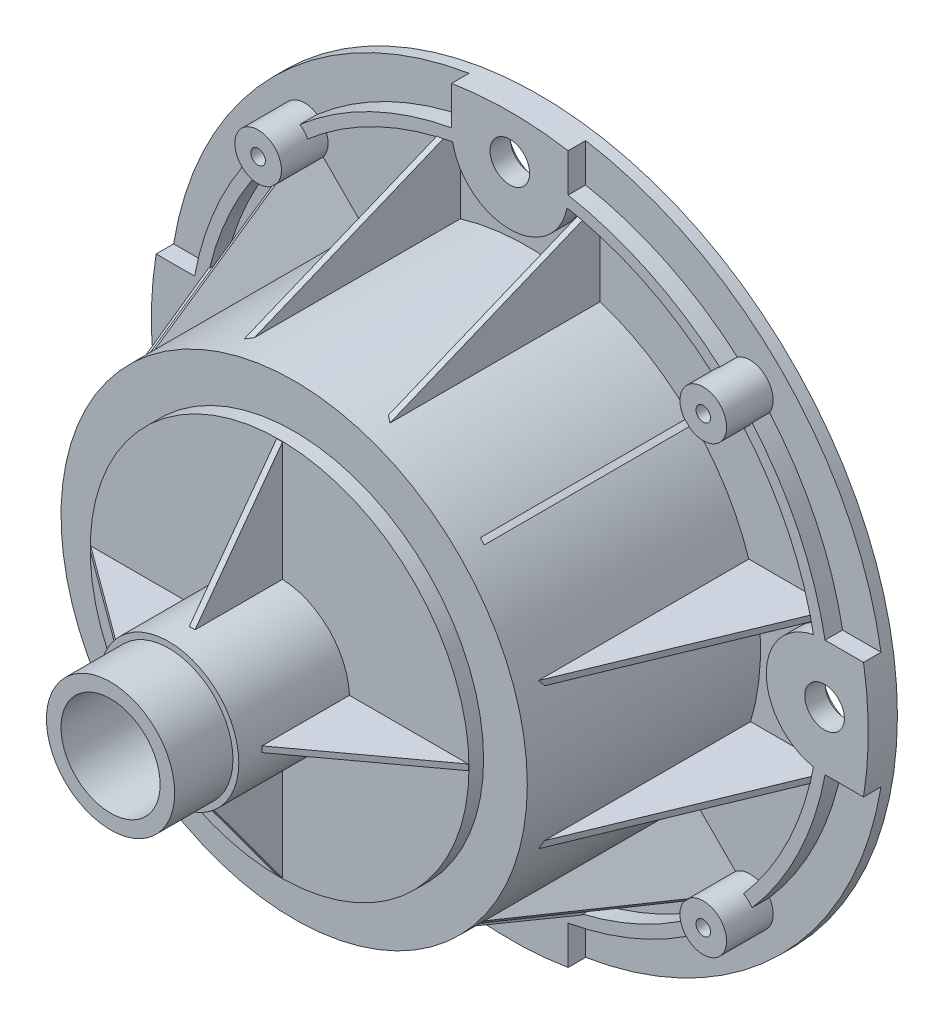
from build123d import *

# Parameters (mm, degrees)
SKETCH_2_R                         = 40
EXTRUDE_1_DEPTH                    = 46
EXTRUDE_START                      = 4
SKETCH_3_R                         = 61.5
EXTRUDE_2_DEPTH                    = 2
EXTRUDE_START_2                    = -2
EXTRUDE_3_DEPTH                    = 5
PATTERN_CIRCULAR_1_COUNT           = 4
SKETCH_5_R                         = 55
SKETCH_5_R_2                       = 53
EXTRUDE_1_2_DEPTH                  = 3
SKETCH_6_R                         = 4
EXTRUDE_4_DEPTH                    = 8
PATTERN_CIRCULAR_2_COUNT           = 4
SKETCH_7_R                         = 32.5
EXTRUDE_5_DEPTH                    = 2.5
SKETCH_8_R                         = 38
CUT_EXTRUDE_1_DEPTH                = 44
SKETCH_10_R                        = 30.5
CUT_EXTRUDE_2_DEPTH                = 2.5
EXTRUDE_7_DEPTH                    = 29
EXTRUDE_7_DEPTH_BACK               = 5
SKETCH_13_R                        = 12
SKETCH_14_OUTSIDE_W                = 163.086
SKETCH_14_OUTSIDE_H                = 163.086
SKETCH_14_OUTSIDE_R                = 11
CUT_EXTRUDE_3_DEPTH                = 10
SKETCH_15_R                        = 8.5
CUT_EXTRUDE_4_DEPTH                = 117.493562054
EXTRUDE_START_3                    = 3
EXTRUDE_8_DEPTH                    = 3
PATTERN_CIRCULAR_3_COUNT           = 8
RIB_1_REACH                        = 118.494
SKETCH_17_WALL_W                   = 260.308261522
SKETCH_17_WALL_H                   = 1
PATTERN_CIRCULAR_4_COUNT           = 4
RIB_2_REACH                        = 125.251
SKETCH_18_WALL_W                   = 284.190764808
SKETCH_18_WALL_H                   = 1
PATTERN_CIRCULAR_5_COPY_1_REACH    = 125.251
PATTERN_CIRCULAR_5_COPY_1_SKETCH_W = 284.190764808
PATTERN_CIRCULAR_5_COPY_1_SKETCH_H = 1
PATTERN_CIRCULAR_5_COPY_2_REACH    = 125.251
PATTERN_CIRCULAR_5_COPY_2_SKETCH_W = 284.190764808
PATTERN_CIRCULAR_5_COPY_2_SKETCH_H = 1
PATTERN_CIRCULAR_5_COPY_3_REACH    = 125.251
PATTERN_CIRCULAR_5_COPY_3_SKETCH_W = 284.190764808
PATTERN_CIRCULAR_5_COPY_3_SKETCH_H = 1
PATTERN_CIRCULAR_5_COPY_4_REACH    = 125.251
PATTERN_CIRCULAR_5_COPY_4_SKETCH_W = 284.190764808
PATTERN_CIRCULAR_5_COPY_4_SKETCH_H = 1
PATTERN_CIRCULAR_5_COPY_5_REACH    = 125.251
PATTERN_CIRCULAR_5_COPY_5_SKETCH_W = 284.190764808
PATTERN_CIRCULAR_5_COPY_5_SKETCH_H = 1
PATTERN_CIRCULAR_5_COPY_6_REACH    = 125.251
PATTERN_CIRCULAR_5_COPY_6_SKETCH_W = 284.190764808
PATTERN_CIRCULAR_5_COPY_6_SKETCH_H = 1
RIB_3_REACH                        = 118.494
SKETCH_19_WALL_W                   = 264.747215978
SKETCH_19_WALL_H                   = 1
PATTERN_CIRCULAR_6_COUNT           = 4
SKETCH_20_R                        = 3.4
CUT_EXTRUDE_5_DEPTH                = 111.710207298
SKETCH_21_R                        = 5.25
CUT_EXTRUDE_6_DEPTH                = 1.5
PATTERN_CIRCULAR_7_COUNT           = 4
SKETCH_22_R                        = 1.25
CUT_EXTRUDE_7_DEPTH                = 108.68820734
PATTERN_CIRCULAR_8_COUNT           = 4


with BuildPart() as part:
    # 草图2 → Extrude 1 (new body)
    with BuildSketch(Plane.XY):
        Circle(SKETCH_2_R)
    extrude(amount=EXTRUDE_1_DEPTH)

    # 草图3 → 凸台-拉伸2 (add)
    with BuildSketch(Plane.XY.offset(EXTRUDE_START)):
        Circle(SKETCH_3_R)
    extrude(amount=EXTRUDE_2_DEPTH)

    # 草图4 → 凸台-拉伸3 (add)
    with BuildSketch(Plane.XY.offset(6).offset(EXTRUDE_START_2)):
        with BuildLine():
            Line((10, 54), (10, 60.681545794))
            ThreePointArc((10, 60.681545794), (0, 61.5), (-10, 60.681545794))
            Line((-10, 60.681545794), (-10, 54))
            ThreePointArc((-10, 54), (0, 44), (10, 54))
        make_face()
    extrude_3 = extrude(amount=EXTRUDE_3_DEPTH)

    # 阵列(圆周)1: 凸台-拉伸3 ×4 about axis
    pattern_circular_1_axis = Axis((0, 0, 6), (0, 0, 1))
    for i in range(1, PATTERN_CIRCULAR_1_COUNT):
        add(extrude_3.rotate(pattern_circular_1_axis, i * 360 / PATTERN_CIRCULAR_1_COUNT))

    # 草图5 → Extrude 1 2 (add)
    with BuildSketch(Plane.XY.offset(6)):
        Circle(SKETCH_5_R)
        Circle(SKETCH_5_R_2, mode=Mode.SUBTRACT)
    extrude(amount=EXTRUDE_1_2_DEPTH)

    # 草图6 → 凸台-拉伸4 (add)
    with BuildSketch(Plane.XY.offset(6)):
        with Locations((-38.183766184, 38.183766184)):
            Circle(SKETCH_6_R)
    extrude_4 = extrude(amount=EXTRUDE_4_DEPTH)

    # 阵列(圆周)2: 凸台-拉伸4 ×4 about axis
    pattern_circular_2_axis = Axis((0, 0, 6), (0, 0, 1))
    for i in range(1, PATTERN_CIRCULAR_2_COUNT):
        add(extrude_4.rotate(pattern_circular_2_axis, i * 360 / PATTERN_CIRCULAR_2_COUNT))

    # 草图7 → 凸台-拉伸5 (add)
    with BuildSketch(Plane.XY.offset(46)):
        Circle(SKETCH_7_R)
    extrude(amount=EXTRUDE_5_DEPTH)

    # 草图8 → 切除-拉伸1 (cut)
    with BuildSketch(Plane(origin=(0, 0, 0), x_dir=(-1, 0, 0), z_dir=(0, 0, -1))):
        Circle(SKETCH_8_R)
    extrude(amount=-CUT_EXTRUDE_1_DEPTH, mode=Mode.SUBTRACT)

    # 草图10 → 切除-拉伸2 (cut)
    with BuildSketch(Plane(origin=(0, 0, 44), x_dir=(-1, 0, 0), z_dir=(0, 0, -1))):
        Circle(SKETCH_10_R)
    extrude(amount=-CUT_EXTRUDE_2_DEPTH, mode=Mode.SUBTRACT)

    # 草图13 → 凸台-拉伸7 (add, two sides: drawn at the far end of the back side and taken through both)
    with BuildSketch(Plane.XY.offset(48.5).offset(-EXTRUDE_7_DEPTH_BACK)):
        Circle(SKETCH_13_R)
    extrude(amount=EXTRUDE_7_DEPTH + EXTRUDE_7_DEPTH_BACK)

    # 草图14 outside → 切除-拉伸3 (cut)
    with BuildSketch(Plane.XY.offset(77.5)):
        Rectangle(SKETCH_14_OUTSIDE_W, SKETCH_14_OUTSIDE_H)
        Circle(SKETCH_14_OUTSIDE_R, mode=Mode.SUBTRACT)
    extrude(amount=-CUT_EXTRUDE_3_DEPTH, mode=Mode.SUBTRACT)

    # 草图15 → 切除-拉伸4 (cut, through all)
    with BuildSketch(Plane.XY.offset(77.5)):
        Circle(SKETCH_15_R)
    extrude(amount=-CUT_EXTRUDE_4_DEPTH, mode=Mode.SUBTRACT)

    # 草图16 → 凸台-拉伸8 (add)
    with BuildSketch(Plane(origin=(0, 0, 44), x_dir=(-1, 0, 0), z_dir=(0, 0, -1)).offset(EXTRUDE_START_3)):
        with BuildLine():
            Line((-1.5, 37.970383195), (-1.5, 34.5))
            ThreePointArc((-1.5, 34.5), (0, 33), (1.5, 34.5))
            Line((1.5, 34.5), (1.5, 37.970383195))
            ThreePointArc((1.5, 37.970383195), (0, 38), (-1.5, 37.970383195))
        make_face()
    extrude_8 = extrude(amount=-EXTRUDE_8_DEPTH)

    # 阵列(圆周)3: 凸台-拉伸8 ×8 about axis
    pattern_circular_3_axis = Axis((0, 0, 0), (0, 0, 1))
    for i in range(1, PATTERN_CIRCULAR_3_COUNT):
        add(extrude_8.rotate(pattern_circular_3_axis, i * 360 / PATTERN_CIRCULAR_3_COUNT))

    # 草图17 wall → 筋1 (add, up to next)
    with BuildSketch(Plane(origin=(22.2, 0, 56), x_dir=(0.805651012649, 0, -0.592390450478), z_dir=(-0.592390450478, 0, -0.805651012649)), mode=Mode.PRIVATE) as rib_1_sk1:
        Rectangle(SKETCH_17_WALL_W, SKETCH_17_WALL_H)
    rib_1_tool1 = extrude(rib_1_sk1.sketch, amount=RIB_1_REACH, mode=Mode.PRIVATE) - part.part
    rib_1 = rib_1_tool1.solids().sort_by_distance((22.2, 0, 56))[0]
    add(rib_1)

    # 阵列(圆周)4: 筋1 ×4 about axis
    pattern_circular_4_axis = Axis((0, 0, 48.5), (0, 0, 1))
    for i in range(1, PATTERN_CIRCULAR_4_COUNT):
        add(rib_1.rotate(pattern_circular_4_axis, i * 360 / PATTERN_CIRCULAR_4_COUNT))

    # 草图18 wall → 筋2 (add, up to next)
    with BuildSketch(Plane(origin=(12, 44.828012517, 25.5), x_dir=(0, 0.380822052291, -0.924648346394), z_dir=(0, 0.924648346394, 0.380822052291)), mode=Mode.PRIVATE) as rib_2_sk1:
        Rectangle(SKETCH_18_WALL_W, SKETCH_18_WALL_H)
    rib_2_tool1 = extrude(rib_2_sk1.sketch, amount=-RIB_2_REACH, mode=Mode.PRIVATE) - part.part
    rib_2 = rib_2_tool1.solids().sort_by_distance((12, 44.828012517, 25.5))[0]
    add(rib_2)

    # 镜向1: 筋2 across plane
    add(rib_2.mirror(Plane(origin=(0, 0, 0), x_dir=(0, 0, 1), z_dir=(1, 0, 0))))

    # 阵列(圆周)5 copy 1 sketch → 阵列(圆周)5 copy 1 (add, up to next)
    with BuildSketch(Plane(origin=(-44.828012517, -12, 25.5), x_dir=(-0.380822052291, 0, -0.924648346394), z_dir=(-0.924648346394, 0, 0.380822052291)), mode=Mode.PRIVATE) as pattern_circular_5_copy_1_sk1:
        Rectangle(PATTERN_CIRCULAR_5_COPY_1_SKETCH_W, PATTERN_CIRCULAR_5_COPY_1_SKETCH_H)
    pattern_circular_5_copy_1_tool1 = extrude(pattern_circular_5_copy_1_sk1.sketch, amount=-PATTERN_CIRCULAR_5_COPY_1_REACH, mode=Mode.PRIVATE) - part.part
    add(pattern_circular_5_copy_1_tool1.solids().sort_by_distance((-44.828012517, -12, 25.5))[0])

    # 阵列(圆周)5 copy 2 sketch → 阵列(圆周)5 copy 2 (add, up to next)
    with BuildSketch(Plane(origin=(12, -44.828012517, 25.5), x_dir=(0, -0.380822052291, -0.924648346394), z_dir=(0, -0.924648346394, 0.380822052291)), mode=Mode.PRIVATE) as pattern_circular_5_copy_2_sk1:
        Rectangle(PATTERN_CIRCULAR_5_COPY_2_SKETCH_W, PATTERN_CIRCULAR_5_COPY_2_SKETCH_H)
    pattern_circular_5_copy_2_tool1 = extrude(pattern_circular_5_copy_2_sk1.sketch, amount=-PATTERN_CIRCULAR_5_COPY_2_REACH, mode=Mode.PRIVATE) - part.part
    add(pattern_circular_5_copy_2_tool1.solids().sort_by_distance((12, -44.828012517, 25.5))[0])

    # 阵列(圆周)5 copy 3 sketch → 阵列(圆周)5 copy 3 (add, up to next)
    with BuildSketch(Plane(origin=(44.828012517, 12, 25.5), x_dir=(0.380822052291, 0, -0.924648346394), z_dir=(0.924648346394, 0, 0.380822052291)), mode=Mode.PRIVATE) as pattern_circular_5_copy_3_sk1:
        Rectangle(PATTERN_CIRCULAR_5_COPY_3_SKETCH_W, PATTERN_CIRCULAR_5_COPY_3_SKETCH_H)
    pattern_circular_5_copy_3_tool1 = extrude(pattern_circular_5_copy_3_sk1.sketch, amount=-PATTERN_CIRCULAR_5_COPY_3_REACH, mode=Mode.PRIVATE) - part.part
    add(pattern_circular_5_copy_3_tool1.solids().sort_by_distance((44.828012517, 12, 25.5))[0])

    # 阵列(圆周)5 copy 4 sketch → 阵列(圆周)5 copy 4 (add, up to next)
    with BuildSketch(Plane(origin=(-44.828012517, 12, 25.5), x_dir=(-0.380822052291, 0, -0.924648346394), z_dir=(-0.924648346394, 0, 0.380822052291)), mode=Mode.PRIVATE) as pattern_circular_5_copy_4_sk1:
        Rectangle(PATTERN_CIRCULAR_5_COPY_4_SKETCH_W, PATTERN_CIRCULAR_5_COPY_4_SKETCH_H)
    pattern_circular_5_copy_4_tool1 = extrude(pattern_circular_5_copy_4_sk1.sketch, amount=-PATTERN_CIRCULAR_5_COPY_4_REACH, mode=Mode.PRIVATE) - part.part
    add(pattern_circular_5_copy_4_tool1.solids().sort_by_distance((-44.828012517, 12, 25.5))[0])

    # 阵列(圆周)5 copy 5 sketch → 阵列(圆周)5 copy 5 (add, up to next)
    with BuildSketch(Plane(origin=(-12, -44.828012517, 25.5), x_dir=(0, -0.380822052291, -0.924648346394), z_dir=(0, -0.924648346394, 0.380822052291)), mode=Mode.PRIVATE) as pattern_circular_5_copy_5_sk1:
        Rectangle(PATTERN_CIRCULAR_5_COPY_5_SKETCH_W, PATTERN_CIRCULAR_5_COPY_5_SKETCH_H)
    pattern_circular_5_copy_5_tool1 = extrude(pattern_circular_5_copy_5_sk1.sketch, amount=-PATTERN_CIRCULAR_5_COPY_5_REACH, mode=Mode.PRIVATE) - part.part
    add(pattern_circular_5_copy_5_tool1.solids().sort_by_distance((-12, -44.828012517, 25.5))[0])

    # 阵列(圆周)5 copy 6 sketch → 阵列(圆周)5 copy 6 (add, up to next)
    with BuildSketch(Plane(origin=(44.828012517, -12, 25.5), x_dir=(0.380822052291, 0, -0.924648346394), z_dir=(0.924648346394, 0, 0.380822052291)), mode=Mode.PRIVATE) as pattern_circular_5_copy_6_sk1:
        Rectangle(PATTERN_CIRCULAR_5_COPY_6_SKETCH_W, PATTERN_CIRCULAR_5_COPY_6_SKETCH_H)
    pattern_circular_5_copy_6_tool1 = extrude(pattern_circular_5_copy_6_sk1.sketch, amount=-PATTERN_CIRCULAR_5_COPY_6_REACH, mode=Mode.PRIVATE) - part.part
    add(pattern_circular_5_copy_6_tool1.solids().sort_by_distance((44.828012517, -12, 25.5))[0])

    # 草图19 wall → 筋3 (add, up to next)
    with BuildSketch(Plane(origin=(31.849083095, 31.849083095, 28), x_dir=(0.239569949182, 0.239569949182, -0.940857310594), z_dir=(-0.66528658445, -0.66528658445, -0.338803071271)), mode=Mode.PRIVATE) as rib_3_sk1:
        Rectangle(SKETCH_19_WALL_W, SKETCH_19_WALL_H)
    rib_3_tool1 = extrude(rib_3_sk1.sketch, amount=RIB_3_REACH, mode=Mode.PRIVATE) - part.part
    rib_3 = rib_3_tool1.solids().sort_by_distance((31.849083095, 31.849083095, 28))[0]
    add(rib_3)

    # 阵列(圆周)6: 筋3 ×4 about axis
    pattern_circular_6_axis = Axis((0, 0, 6), (0, 0, 1))
    for i in range(1, PATTERN_CIRCULAR_6_COUNT):
        add(rib_3.rotate(pattern_circular_6_axis, i * 360 / PATTERN_CIRCULAR_6_COUNT))

    # 草图20 → 切除-拉伸5 (cut, through all)
    with BuildSketch(Plane.XY.offset(9)):
        with Locations((54, 0)):
            Circle(SKETCH_20_R)
    cut_extrude_5 = extrude(amount=-CUT_EXTRUDE_5_DEPTH, mode=Mode.SUBTRACT)

    # 草图21 → 切除-拉伸6 (cut)
    with BuildSketch(Plane(origin=(0, 0, 4), x_dir=(-1, 0, 0), z_dir=(0, 0, -1))):
        with Locations((-54, 0)):
            Circle(SKETCH_21_R)
    cut_extrude_6 = extrude(amount=-CUT_EXTRUDE_6_DEPTH, mode=Mode.SUBTRACT)

    # 阵列(圆周)7: 切除-拉伸5, 切除-拉伸6 ×4 about axis
    pattern_circular_7_axis = Axis((0, 0, 46), (0, 0, -1))
    add([cut_extrude_5.rotate(pattern_circular_7_axis, i * 360 / PATTERN_CIRCULAR_7_COUNT) for i in range(1, PATTERN_CIRCULAR_7_COUNT)], mode=Mode.SUBTRACT)
    add([cut_extrude_6.rotate(pattern_circular_7_axis, i * 360 / PATTERN_CIRCULAR_7_COUNT) for i in range(1, PATTERN_CIRCULAR_7_COUNT)], mode=Mode.SUBTRACT)

    # 草图22 → 切除-拉伸7 (cut, through all)
    with BuildSketch(Plane.XY.offset(14)):
        with Locations((-38.183766184, 38.183766184)):
            Circle(SKETCH_22_R)
    cut_extrude_7 = extrude(amount=-CUT_EXTRUDE_7_DEPTH, mode=Mode.SUBTRACT)

    # 阵列(圆周)8: 切除-拉伸7 ×4 about axis
    pattern_circular_8_axis = Axis((0, 0, 6), (0, 0, 1))
    for i in range(1, PATTERN_CIRCULAR_8_COUNT):
        add(cut_extrude_7.rotate(pattern_circular_8_axis, i * 360 / PATTERN_CIRCULAR_8_COUNT), mode=Mode.SUBTRACT)


solid = part.part
